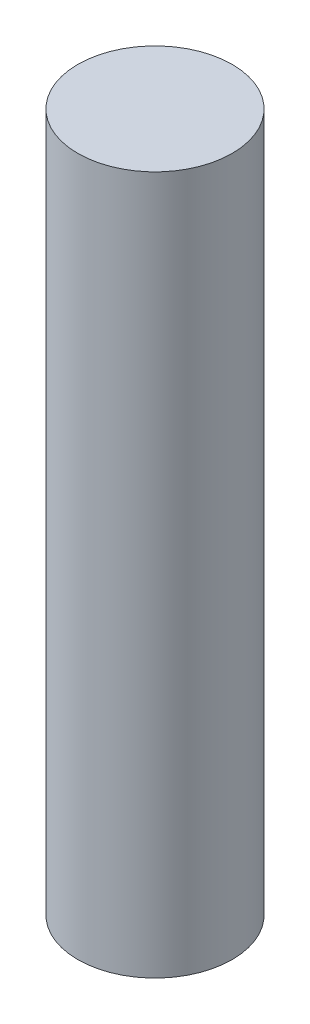
from build123d import *

# Parameters (mm, degrees)
IZIM1_R                     = 20
Y_KSEKLIK_EKSTR_ZYON1_DEPTH = 181


with BuildPart() as part:
    # Çizim1 → Yükseklik-Ekstrüzyon1 (new body)
    with BuildSketch(Plane(origin=(0, 0, 0), x_dir=(1, 0, 0), z_dir=(0, 1, 0))):
        with Locations(Location((0, 0, 0), (0, 0, 270))):
            Circle(IZIM1_R)
    extrude(amount=Y_KSEKLIK_EKSTR_ZYON1_DEPTH)


solid = part.part
